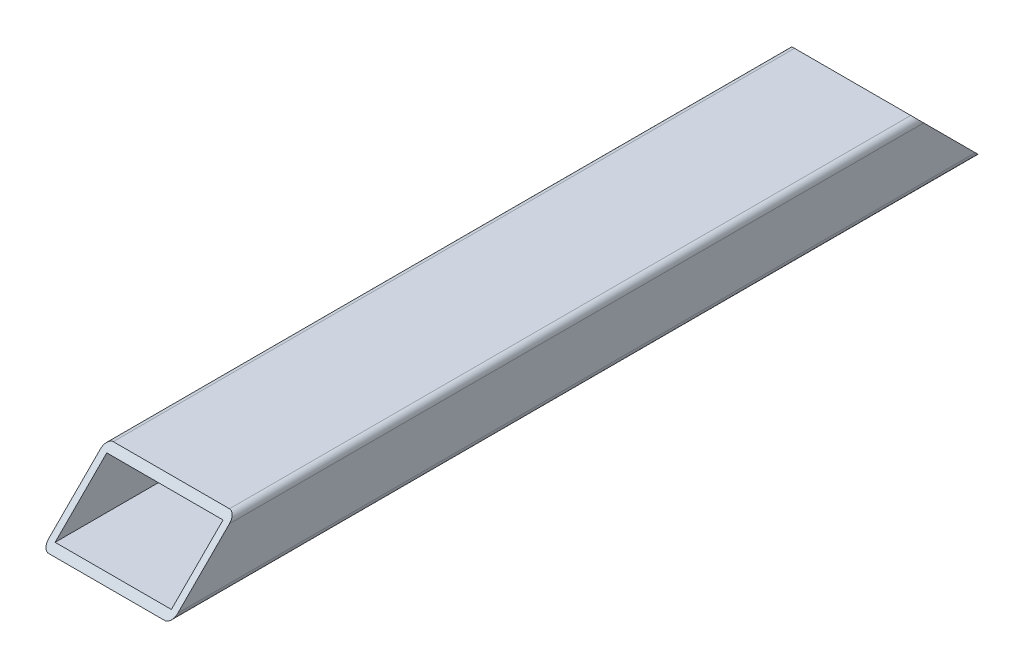
from build123d import *

# Parameters (mm, degrees)
Y_KSEKLIK_EKSTR_ZYON1_DEPTH      = 251
Y_KSEKLIK_EKSTR_ZYON1_DEPTH_BACK = 251
IZIM1_W                          = 72
IZIM1_H                          = 32
KES_EKSTR_ZYON1_DEPTH            = 75
KES_EKSTR_ZYON1_DEPTH_BACK       = 86


with BuildPart() as part:
    # Çizim1 → Yükseklik-Ekstrüzyon1 (new, two sides: drawn at the far end of the back side and taken through both)
    with BuildSketch(Plane.XY.offset(-Y_KSEKLIK_EKSTR_ZYON1_DEPTH_BACK)):
        with BuildLine():
            Line((-36, 20), (36, 20))
            ThreePointArc((36, 20), (38.828427125, 18.828427125), (40, 16))
            Line((40, 16), (40, -16))
            ThreePointArc((40, -16), (38.828427125, -18.828427125), (36, -20))
            Line((36, -20), (-36, -20))
            ThreePointArc((-36, -20), (-38.828427125, -18.828427125), (-40, -16))
            Line((-40, -16), (-40, 16))
            ThreePointArc((-40, 16), (-38.828427125, 18.828427125), (-36, 20))
        make_face()
        Rectangle(IZIM1_W, IZIM1_H, mode=Mode.SUBTRACT)
    extrude(amount=Y_KSEKLIK_EKSTR_ZYON1_DEPTH + Y_KSEKLIK_EKSTR_ZYON1_DEPTH_BACK)

    # Çizim2 → Kes-Ekstrüzyon1 (cut, two sides: drawn at the far end of the back side and taken through both)
    with BuildSketch(Plane(origin=(0, 0, 0), x_dir=(0, 0, -1), z_dir=(1, 0, 0)).offset(-KES_EKSTR_ZYON1_DEPTH_BACK)):
        Polygon((-251, 20), (-211, 20), (-251, -20), align=None)
        Polygon((251, -20), (211, 20), (251, 20), align=None)
    extrude(amount=KES_EKSTR_ZYON1_DEPTH + KES_EKSTR_ZYON1_DEPTH_BACK, mode=Mode.SUBTRACT)


solid = part.part
